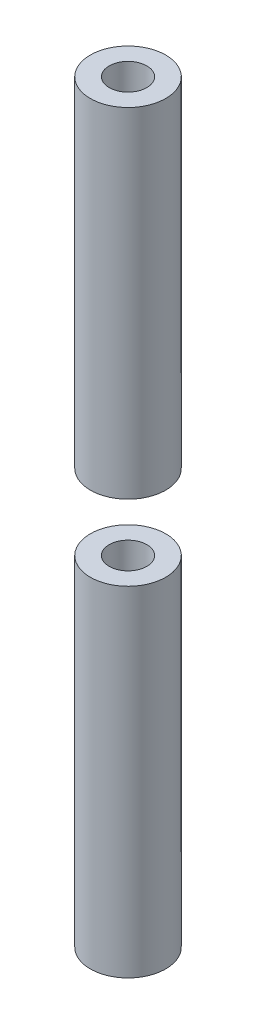
from build123d import *

# Parameters (mm, degrees)
SKETCH2_R           = 2.5
BOSS_EXTRUDE1_DEPTH = 60
CUT_EXTRUDE1_DEPTH  = 5
SKETCH6_R           = 1.25
CUT_EXTRUDE2_DEPTH  = 60
SKETCH7_W           = 5.0259895
SKETCH7_H           = 5
CUT_EXTRUDE3_DEPTH  = 25
SKETCH8_W           = 5
SKETCH8_H           = 5
CUT_EXTRUDE4_DEPTH  = 25


with BuildPart() as part:
    # Sketch2 → Boss-Extrude1 (new body)
    with BuildSketch(Plane(origin=(0, 0, 0), x_dir=(1, 0, 0), z_dir=(0, 1, 0))):
        with Locations(Location((0, 0, 0), (0, 0, 90))):
            Circle(SKETCH2_R)
    extrude(amount=BOSS_EXTRUDE1_DEPTH)

    # Sketch4 → Cut-Extrude1 (cut, symmetric)
    with BuildSketch(Plane(origin=(0, 0, 0), x_dir=(0, 0, -1), z_dir=(1, 0, 0))):
        Polygon((0, 32.5), (14.138418726, 32.5), (14.138418726, 27.5), (-5.192428116, 27.5), (-5.192428116, 32.5), align=None)
    extrude(amount=CUT_EXTRUDE1_DEPTH, both=True, mode=Mode.SUBTRACT)


with BuildPart() as cut_extrude1_piece_1:
    # of the separate pieces the step leaves, piece 1, a body of its own (cut_extrude1_pieces)
    add(part.part.solids().sort_by_distance((0, 32.5, -2.5))[0])


with BuildPart() as cut_extrude1_piece_2:
    # of the separate pieces the step leaves, piece 2, a body of its own (cut_extrude1_pieces)
    add(part.part.solids().sort_by_distance((0, 0, -2.5))[0])


with BuildPart() as cut_extrude2_tool:
    # Sketch6 → Cut-Extrude2 (new body)
    with BuildSketch(Plane(origin=(0, 0, 0), x_dir=(1, 0, 0), z_dir=(0, 1, 0))):
        with Locations(Location((0, 0, 0), (0, 0, 90))):
            Circle(SKETCH6_R)
    extrude(amount=CUT_EXTRUDE2_DEPTH)


with BuildPart() as cut_extrude1_piece_1_1:
    add(cut_extrude1_piece_1.part)

    # Cut-Extrude2: cut by cut_extrude2_tool
    add(cut_extrude2_tool.part, mode=Mode.SUBTRACT)

    # Sketch7 → Cut-Extrude3 (cut, symmetric)
    with BuildSketch(Plane(origin=(0, 0, 0), x_dir=(0, 0, -1), z_dir=(1, 0, 0))):
        with Locations((0.01299475, 57.5)):
            Rectangle(SKETCH7_W, SKETCH7_H)
    extrude(amount=CUT_EXTRUDE3_DEPTH, both=True, mode=Mode.SUBTRACT)


with BuildPart() as cut_extrude1_piece_2_1:
    add(cut_extrude1_piece_2.part)

    # Cut-Extrude2: cut by cut_extrude2_tool
    add(cut_extrude2_tool.part, mode=Mode.SUBTRACT)

    # Sketch8 → Cut-Extrude4 (cut, symmetric)
    with BuildSketch(Plane(origin=(0, 0, 0), x_dir=(0, 0, -1), z_dir=(1, 0, 0))):
        with Locations((0, 2.5)):
            Rectangle(SKETCH8_W, SKETCH8_H)
    extrude(amount=CUT_EXTRUDE4_DEPTH, both=True, mode=Mode.SUBTRACT)


solid = Compound([cut_extrude1_piece_1_1.part, cut_extrude1_piece_2_1.part])
